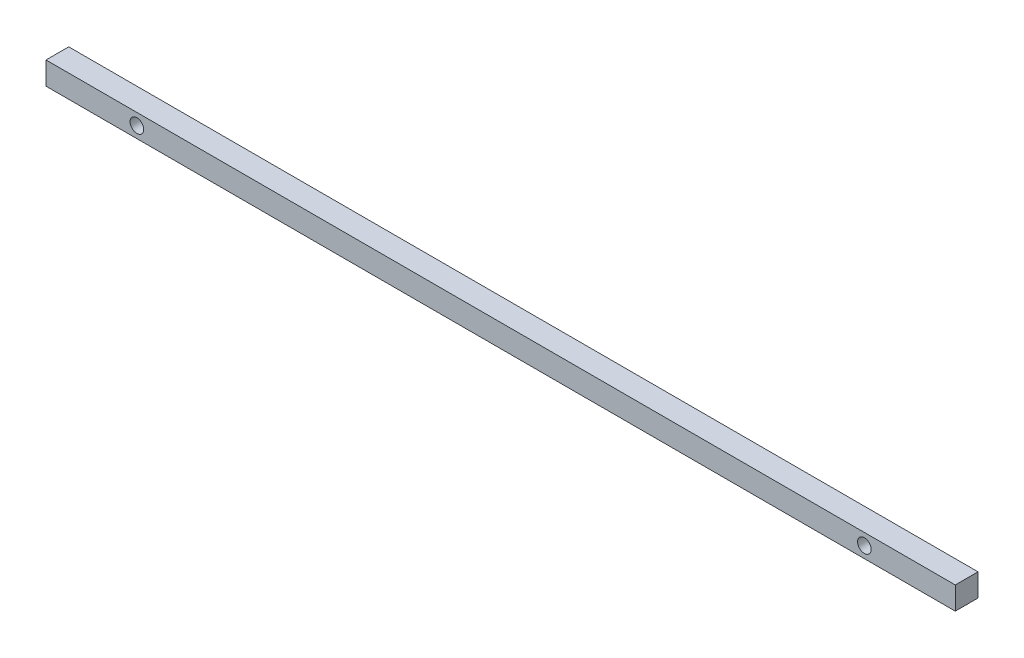
from build123d import *

# Parameters (mm, degrees)
CROQUIS1_W              = 400
CROQUIS1_H              = 10
CROQUIS1_R              = 3
SALIENTE_EXTRUIR1_DEPTH = 10


with BuildPart() as part:
    # Croquis1 → Saliente-Extruir1 (new body)
    with BuildSketch(Plane.XY):
        with Locations((200, 5)):
            Rectangle(CROQUIS1_W, CROQUIS1_H)
        with Locations((40, 5)):
            Circle(CROQUIS1_R, mode=Mode.SUBTRACT)
        with Locations((360, 5)):
            Circle(CROQUIS1_R, mode=Mode.SUBTRACT)
    extrude(amount=SALIENTE_EXTRUIR1_DEPTH)


solid = part.part
